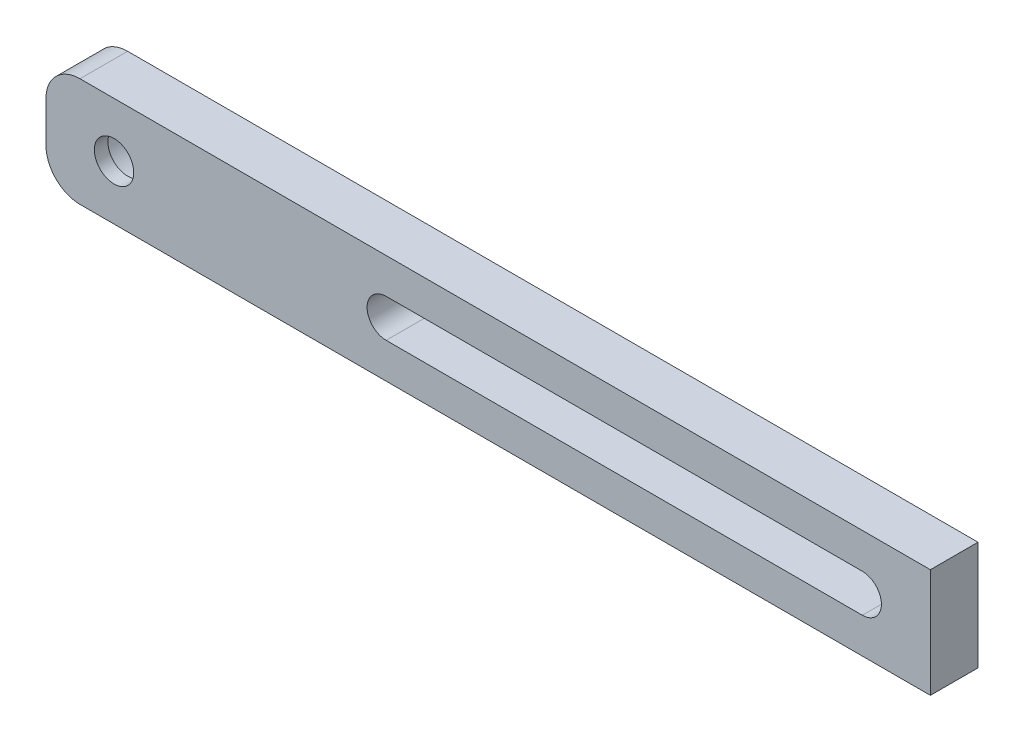
from build123d import *

# Parameters (mm, degrees)
SKETCH_1_W                   = 130
SKETCH_1_H                   = 16
EXTRUDE_1_DEPTH              = 7
HOLE_WIZARD_M5_1_D           = 5.8
HOLE_WIZARD_M5_1_CBORE_D     = 10
HOLE_WIZARD_M5_1_CBORE_DEPTH = 5
FILLET_1_R                   = 5
CUT_EXTRUDE_1_DEPTH          = 132.167831422


with BuildPart() as part:
    # 草图1 → 凸台-拉伸1 (new body)
    with BuildSketch(Plane.XY):
        with Locations((65, 8)):
            Rectangle(SKETCH_1_W, SKETCH_1_H)
    extrude(amount=EXTRUDE_1_DEPTH)

    # M5 六角凹头螺钉的柱形沉头孔1 (through all)
    with Locations(Plane(origin=(0, 0, 0), x_dir=(-1, 0, 0), z_dir=(0, 0, -1))):
        with Locations((-10, 8)):
            CounterBoreHole(HOLE_WIZARD_M5_1_D / 2, HOLE_WIZARD_M5_1_CBORE_D / 2, HOLE_WIZARD_M5_1_CBORE_DEPTH)

    # 圆角1
    fillet_1_edges = [part.edges().sort_by_distance(p)[0] for p in [
        (0, 16, 3.5),
        (0, 0, 3.5),
    ]]
    fillet(fillet_1_edges, radius=FILLET_1_R)

    # 草图4 → 切除-拉伸1 (cut, through all)
    with BuildSketch(Plane(origin=(0, 0, 0), x_dir=(-1, 0, 0), z_dir=(0, 0, -1))):
        with BuildLine():
            Line((-50, 5.2), (-120, 5.2))
            ThreePointArc((-120, 5.2), (-122.8, 8), (-120, 10.8))
            Line((-120, 10.8), (-50, 10.8))
            ThreePointArc((-50, 10.8), (-47.2, 8), (-50, 5.2))
        make_face()
    extrude(amount=-CUT_EXTRUDE_1_DEPTH, mode=Mode.SUBTRACT)


solid = part.part
